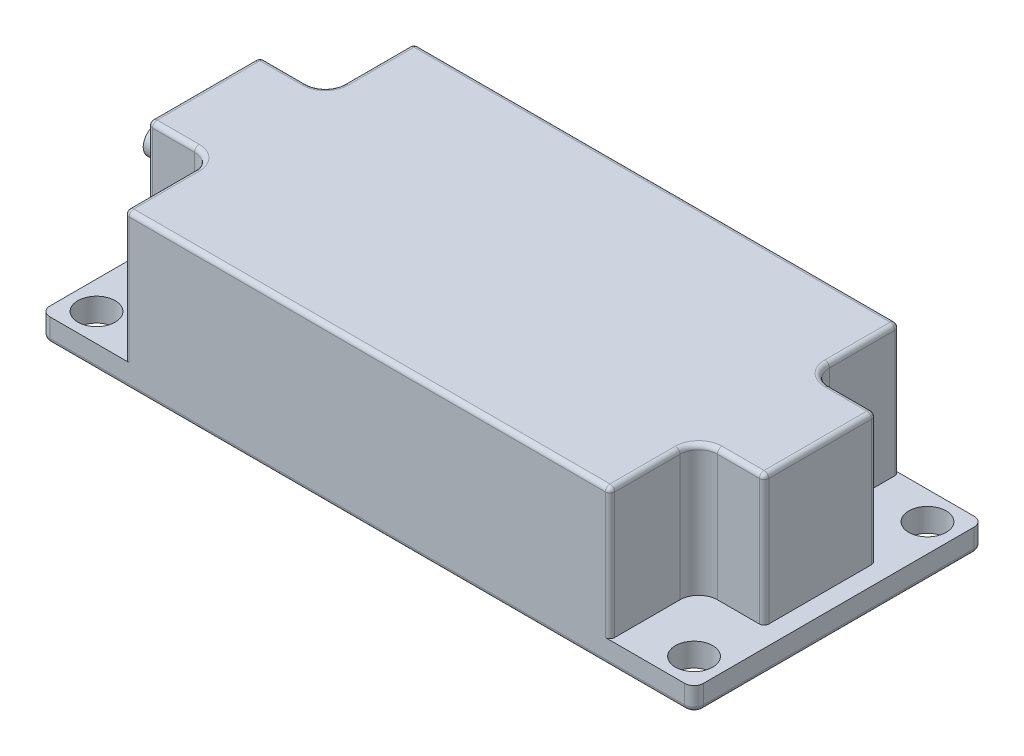
from build123d import *

# Parameters (mm, degrees)
SKETCH_1_R          = 2
EXTRUDE_1_DEPTH     = 2.5
SKETCH_2_W          = 7
SKETCH_2_H          = 12
EXTRUDE_2_DEPTH     = 14
FILLET_1_R          = 2
FILLET_2_R          = 2
FILLET_3_R          = 0.5
CUT_EXTRUDE_1_DEPTH = 0.5
SKETCH_4_R          = 1.5
EXTRUDE_3_DEPTH     = 5
SKETCH_5_R          = 2.5
EXTRUDE_4_DEPTH     = 1


with BuildPart() as part:
    # 草图1 → 凸台-拉伸1 (new body)
    with BuildSketch(Plane(origin=(0, 0, 0), x_dir=(1, 0, 0), z_dir=(0, 1, 0))):
        with BuildLine():
            Line((1, 0), (69, 0))
            ThreePointArc((69, 0), (69.707106781, -0.292893219), (70, -1))
            Line((70, -1), (70, -30))
            ThreePointArc((70, -30), (69.707106781, -30.707106781), (69, -31))
            Line((69, -31), (1, -31))
            ThreePointArc((1, -31), (0.292893219, -30.707106781), (0, -30))
            Line((0, -30), (0, -1))
            ThreePointArc((0, -1), (0.292893219, -0.292893219), (1, 0))
        make_face()
        with Locations(Location((3, -3, 0), (0, 0, 270))):
            Circle(SKETCH_1_R, mode=Mode.SUBTRACT)
        with Locations(Location((67, -3, 0), (0, 0, 90))):
            Circle(SKETCH_1_R, mode=Mode.SUBTRACT)
        with Locations(Location((67, -28, 0), (0, 0, 270))):
            Circle(SKETCH_1_R, mode=Mode.SUBTRACT)
        with Locations(Location((3, -28, 0), (0, 0, 90))):
            Circle(SKETCH_1_R, mode=Mode.SUBTRACT)
    extrude(amount=EXTRUDE_1_DEPTH)

    # 草图2 → 凸台-拉伸2 (add)
    with BuildSketch(Plane(origin=(0, 2.5, 0), x_dir=(1, 0, 0), z_dir=(0, 1, 0))):
        Polygon((61, 0), (9, 0), (9, -9.5), (9, -21.5), (9, -31), (61, -31), (61, -21.5), (61, -9.5), align=None)
        with Locations((5.5, -15.5)):
            Rectangle(SKETCH_2_W, SKETCH_2_H)
        with Locations((64.5, -15.5)):
            Rectangle(SKETCH_2_W, SKETCH_2_H)
    extrude(amount=EXTRUDE_2_DEPTH)

    # 圆角1
    fillet_1_edges = [part.edges().sort_by_distance(p)[0] for p in [
        (9, 9.5, 21.5),
    ]]
    fillet(fillet_1_edges, radius=FILLET_1_R)

    # 圆角2
    fillet_2_edges = [part.edges().sort_by_distance(p)[0] for p in [
        (61, 9.5, 9.5),
        (9, 9.5, 9.5),
        (61, 9.5, 21.5),
    ]]
    fillet(fillet_2_edges, radius=FILLET_2_R)

    # 圆角3
    fillet_3_edges = [part.edges().sort_by_distance(p)[0] for p in [
        (0, 0, 15.5),
        (0.292893219, 0, 0.292893219),
        (35, 0, 0),
        (69.707106781, 0, 0.292893219),
        (61, 16.5, 3.75),
        (61, 9.5, 0),
        (9, 9.5, 0),
        (2, 9.5, 9.5),
        (2, 9.5, 21.5),
        (9, 9.5, 31),
        (61, 9.5, 31),
        (68, 16.5, 15.5),
        (68, 9.5, 21.5),
        (68, 9.5, 9.5),
        (35, 16.5, 0),
        (9, 16.5, 3.75),
        (2, 16.5, 15.5),
        (35, 16.5, 31),
        (9, 16.5, 27.25),
        (4.5, 16.5, 21.5),
        (8.414213562, 16.5, 22.085786438),
        (70, 0, 15.5),
        (65.5, 16.5, 21.5),
        (69.707106781, 0, 30.707106781),
        (61, 16.5, 27.25),
        (65.5, 16.5, 9.5),
        (35, 0, 31),
        (4.5, 16.5, 9.5),
        (61.585786438, 16.5, 22.085786438),
        (0.292893219, 0, 30.707106781),
        (61.585786438, 16.5, 8.914213562),
        (8.414213562, 16.5, 8.914213562),
    ]]
    fillet(fillet_3_edges, radius=FILLET_3_R)

    # 草图3 → 切除-拉伸1 (cut)
    with BuildSketch(Plane.XZ):
        with BuildLine():
            Line((16.290844115, 25.013544626), (32.187512514, 25.013544626))
            ThreePointArc((32.187512514, 25.013544626), (41.70105714, 15.5), (32.187512514, 5.986455374))
            Line((32.187512514, 5.986455374), (16.290844115, 5.986455374))
            ThreePointArc((16.290844115, 5.986455374), (6.777299489, 15.5), (16.290844115, 25.013544626))
        make_face()
    extrude(amount=-CUT_EXTRUDE_1_DEPTH, mode=Mode.SUBTRACT)

    # 草图4 → 凸台-拉伸3 (add)
    with BuildSketch(Plane.ZY.offset(-2)):
        with Locations(Location((15.5, 9.25, 0), (0, 0, 180))):
            Circle(SKETCH_4_R)
    extrude(amount=EXTRUDE_3_DEPTH)

    # 草图5 → 凸台-拉伸4 (add)
    with BuildSketch(Plane.ZY.offset(-2)):
        with Locations(Location((15.5, 9.25, 0), (0, 0, 180))):
            Circle(SKETCH_5_R)
    extrude(amount=EXTRUDE_4_DEPTH)


solid = part.part
